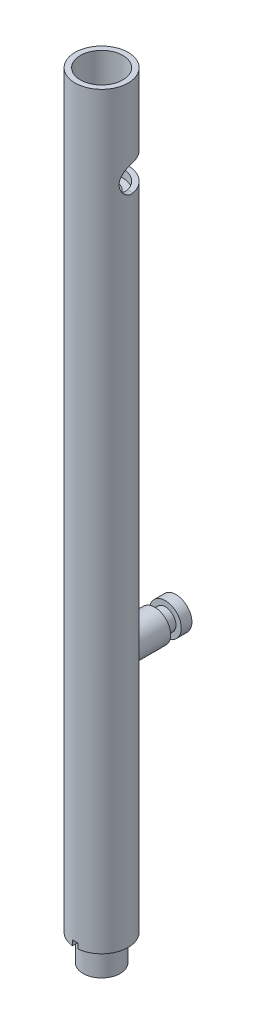
from build123d import *
from build123d.topology import SkipClean

# Parameters (mm, degrees)
SKETCH1_R                            = 5
BOSS_EXTRUDE1_DEPTH                  = 150
SKETCH4_R                            = 3
BOSS_EXTRUDE2_DEPTH                  = 5
BOSS_EXTRUDE2_DIRECTION_2_REACH      = 152.416
BOSS_EXTRUDE2_DIRECTION_2_END_RADIUS = 5
SKETCH5_R                            = 2
BOSS_EXTRUDE3_DEPTH                  = 2
SKETCH6_R                            = 3
BOSS_EXTRUDE4_DEPTH                  = 2
SKETCH7_R                            = 3.5
BOSS_EXTRUDE5_DEPTH                  = 5
BOSS_EXTRUDE6_START                  = 5
SKETCH8_R                            = 3.5
BOSS_EXTRUDE6_DEPTH                  = 5
SKETCH9_R                            = 2.75
CUT_EXTRUDE1_DEPTH                   = 168
CUT_EXTRUDE4_REACH                   = 158.24
CUT_EXTRUDE4_END_RADIUS              = 3.5
BOSS_EXTRUDE7_START                  = 1
BOSS_EXTRUDE7_DEPTH                  = 1
CUT_EXTRUDE5_DEPTH                   = 18
SKETCH19_R                           = 4
CUT_EXTRUDE6_DEPTH                   = 34
SKETCH20_W                           = 24.40949837
SKETCH20_H                           = 28.25498801
CUT_EXTRUDE7_DEPTH                   = 10
BOSS_EXTRUDE8_REACH                  = 143.892
BOSS_EXTRUDE8_END_RADIUS             = 2
SKETCH22_W                           = 2
SKETCH22_H                           = 0.5


with BuildPart() as part:
    # Sketch1 → Boss-Extrude1 (new body)
    with BuildSketch(Plane(origin=(0, 0, 0), x_dir=(1, 0, 0), z_dir=(0, 1, 0))):
        with Locations(Location((0, 0, 0), (0, 0, 270))):
            Circle(SKETCH1_R)
    extrude(amount=BOSS_EXTRUDE1_DEPTH)

    # Sketch7 → Boss-Extrude5 (add)
    with BuildSketch(Plane.XZ):
        with Locations(Location((0, 0, 0), (0, 0, 270))):
            Circle(SKETCH7_R)
    extrude(amount=BOSS_EXTRUDE5_DEPTH)

    # Sketch8 → Boss-Extrude6 (add)
    with BuildSketch(Plane(origin=(0, 150, 0), x_dir=(1, 0, 0), z_dir=(0, 1, 0)).offset(BOSS_EXTRUDE6_START)):
        with Locations(Location((0, 0, 0), (0, 0, 90))):
            Circle(SKETCH8_R)
    extrude(amount=-BOSS_EXTRUDE6_DEPTH)

    # Sketch9 → Cut-Extrude1 (cut)
    with BuildSketch(Plane(origin=(0, 155, 0), x_dir=(1, 0, 0), z_dir=(0, 1, 0))):
        with Locations(Location((0, 0, 0), (0, 0, 270))):
            Circle(SKETCH9_R)
    extrude(amount=-CUT_EXTRUDE1_DEPTH, mode=Mode.SUBTRACT)

    # Cut-Extrude4: up to this cylinder (the profile starts outside it)
    cut_extrude4_end = Plane(origin=(0, 0.5, 0), z_dir=(0, 1, 0)) * Cylinder(CUT_EXTRUDE4_END_RADIUS, 324.48, mode=Mode.PRIVATE)
    # Sketch14 → Cut-Extrude4 (cut, up to the surface)
    with BuildSketch(Plane.XY.offset(5), mode=Mode.PRIVATE) as cut_extrude4_sk1:
        Polygon((0, 0), (0.5, 0), (0.5, 1), (-0.5, 1), (-0.5, 0), align=None)
    cut_extrude4_tool1 = extrude(cut_extrude4_sk1.sketch, amount=-CUT_EXTRUDE4_REACH, mode=Mode.PRIVATE) - cut_extrude4_end
    add(cut_extrude4_tool1.solids().sort_by_distance((0, 0.5, 5))[0], mode=Mode.SUBTRACT)

    # Sketch16 → Boss-Extrude7 (add)
    with BuildSketch(Plane(origin=(0, 150, 0), x_dir=(1, 0, 0), z_dir=(0, 1, 0)).offset(BOSS_EXTRUDE7_START)):
        with BuildLine():
            Line((0.5, -3.5), (0.5, -4.974937186))
            ThreePointArc((0.5, -4.974937186), (0, -5), (-0.5, -4.974937186))
            Line((-0.5, -4.974937186), (-0.5, -3.5))
            Line((-0.5, -3.5), (-0.5, -3.464101615))
            ThreePointArc((-0.5, -3.464101615), (0, -3.5), (0.5, -3.464101615))
            Line((0.5, -3.464101615), (0.5, -3.5))
        make_face()
    extrude(amount=-BOSS_EXTRUDE7_DEPTH)

    # Sketch18 → Cut-Extrude5 (cut)
    with BuildSketch(Plane(origin=(-5, 0, 0), x_dir=(0, 0, -1), z_dir=(1, 0, 0))):
        with BuildLine():
            Line((1.012531407, 127.5), (8.012531407, 127.5))
            Line((8.012531407, 127.5), (8.012531407, 122.5))
            Line((8.012531407, 122.5), (1.012531407, 122.5))
            ThreePointArc((1.012531407, 122.5), (-1.487468593, 125), (1.012531407, 127.5))
        make_face()
    extrude(amount=CUT_EXTRUDE5_DEPTH, mode=Mode.SUBTRACT)

    # Sketch19 → Cut-Extrude6 (cut)
    with BuildSketch(Plane(origin=(0, 155, 0), x_dir=(1, 0, 0), z_dir=(0, 1, 0))):
        with Locations(Location((0, 0, 0), (0, 0, 270))):
            Circle(SKETCH19_R)
    extrude(amount=-CUT_EXTRUDE6_DEPTH, mode=Mode.SUBTRACT)

    # Sketch20 → Cut-Extrude7 (cut)
    with BuildSketch(Plane(origin=(0, 151, 0), x_dir=(1, 0, 0), z_dir=(0, 1, 0))):
        Rectangle(SKETCH20_W, SKETCH20_H)
    extrude(amount=-CUT_EXTRUDE7_DEPTH, mode=Mode.SUBTRACT)


with BuildPart() as body_2:
    # Sketch4 → Boss-Extrude2 (new body)
    with BuildSketch(Plane.XY.offset(-5)):
        with Locations((0, 45)):
            Circle(SKETCH4_R)
    extrude(amount=-BOSS_EXTRUDE2_DEPTH)

    # Boss-Extrude2 direction 2: up to this cylinder (the profile starts outside it)
    with SkipClean():  # the faces are left unmerged after this step: merging them gives an invalid solid
        boss_extrude2_direction_2_end = Plane(origin=(0, 45, 0), z_dir=(0, -1, 0)) * Cylinder(BOSS_EXTRUDE2_DIRECTION_2_END_RADIUS, 315.832, mode=Mode.PRIVATE)
        # Sketch4 → Boss-Extrude2 direction 2 (add, up to the surface)
        with BuildSketch(Plane.XY.offset(-5), mode=Mode.PRIVATE) as boss_extrude2_direction_2_sk1:
            with Locations((0, 45)):
                Circle(SKETCH4_R)
        boss_extrude2_direction_2_tool1 = extrude(boss_extrude2_direction_2_sk1.sketch, amount=BOSS_EXTRUDE2_DIRECTION_2_REACH, mode=Mode.PRIVATE) - boss_extrude2_direction_2_end
        add(boss_extrude2_direction_2_tool1.solids().sort_by_distance((0, 45, -5))[0])
        add(boss_extrude2_direction_2_tool1.solids().sort_by_distance((0, 45, -5))[1])

    # Sketch5 → Boss-Extrude3 (add)
    with SkipClean():  # the faces are left unmerged after this step: merging them gives an invalid solid
        with BuildSketch(Plane(origin=(0, 0, -10), x_dir=(-1, 0, 0), z_dir=(0, 0, -1))):
            with Locations((0, 45.074078642)):
                Circle(SKETCH5_R)
        extrude(amount=BOSS_EXTRUDE3_DEPTH)

    # Sketch6 → Boss-Extrude4 (add)
    with SkipClean():  # the faces are left unmerged after this step: merging them gives an invalid solid
        with BuildSketch(Plane(origin=(0, 0, -12), x_dir=(-1, 0, 0), z_dir=(0, 0, -1))):
            with Locations((0, 45.074078642)):
                Circle(SKETCH6_R)
        extrude(amount=BOSS_EXTRUDE4_DEPTH)

    # Boss-Extrude8: up to this cylinder (the profile starts outside it)
    with SkipClean():  # the faces are left unmerged after this step: merging them gives an invalid solid
        boss_extrude8_end = Plane(origin=(0, 45.074078642, -11), z_dir=(0, 0, 1)) * Cylinder(BOSS_EXTRUDE8_END_RADIUS, 292.784, mode=Mode.PRIVATE)
        # Sketch22 → Boss-Extrude8 (add, up to the surface)
        with BuildSketch(Plane(origin=(-2.5, 0, 0), x_dir=(0, 0, -1), z_dir=(1, 0, 0)), mode=Mode.PRIVATE) as boss_extrude8_sk1:
            with Locations((11, 44.824078642)):
                Rectangle(SKETCH22_W, SKETCH22_H)
        boss_extrude8_tool1 = extrude(boss_extrude8_sk1.sketch, amount=BOSS_EXTRUDE8_REACH, mode=Mode.PRIVATE) - boss_extrude8_end
        add(boss_extrude8_tool1.solids().sort_by_distance((-2.5, 44.824079, -11))[0])


solid = Compound([part.part, body_2.part])
